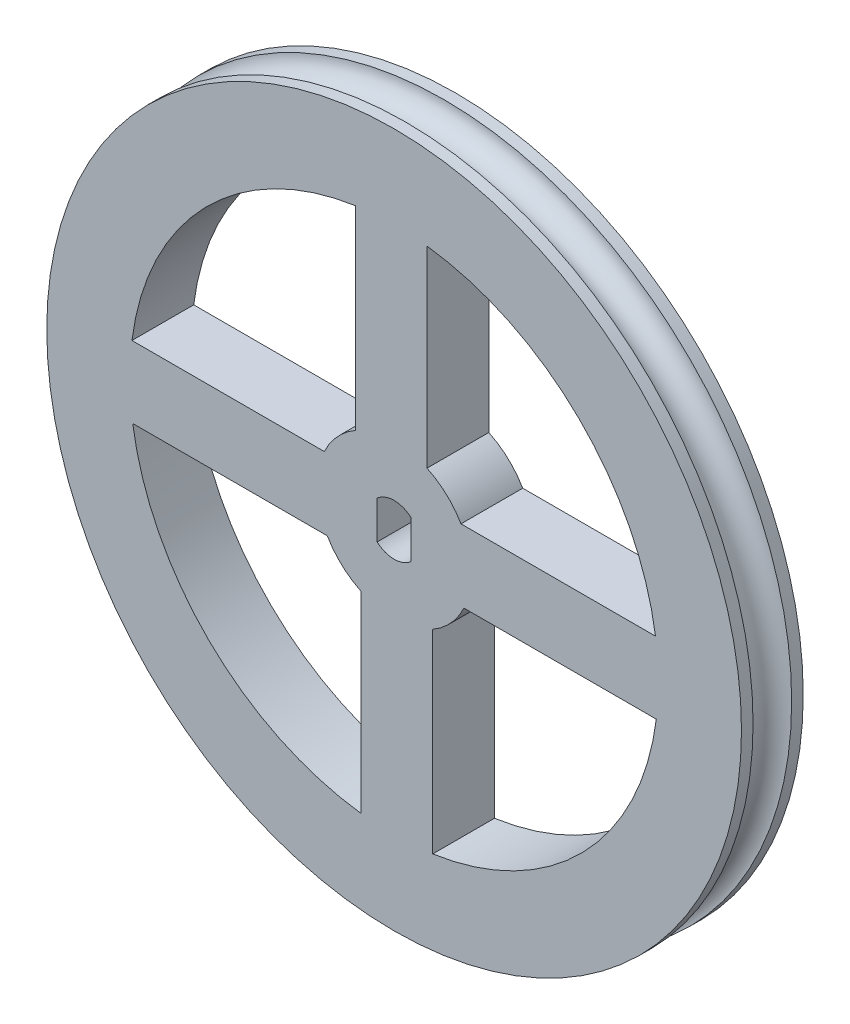
from build123d import *

# Parameters (mm, degrees)
CUT_EXTRUDE2_DEPTH = 82.458397971
CUT_EXTRUDE3_DEPTH = 82.458397971


with BuildPart() as part:
    # Sketch1 → Revolve1 (revolve)
    with BuildSketch(Plane(origin=(0, 0, 0), x_dir=(1, 0, 0), z_dir=(0, 1, 0))):
        with BuildLine():
            Line((-57.15, 0), (-57.15, -1.905))
            ThreePointArc((-57.15, -1.905), (-53.975, -5.08), (-57.15, -8.255))
            Line((-57.15, -8.255), (-57.15, -10.16))
            Line((-57.15, -10.16), (0, -10.16))
            Line((0, -10.16), (0, 0))
            Line((0, 0), (-57.15, 0))
        make_face()
    revolve(axis=Axis((0, 0, 0), (0, 0, 1)))

    # Sketch3 → Cut-Extrude2 (cut, through all)
    with BuildSketch(Plane(origin=(0, 0, 0), x_dir=(-1, 0, 0), z_dir=(0, 0, -1))):
        with BuildLine():
            Line((6.35, 43.004116755), (6.35, 10.998522628))
            ThreePointArc((6.35, 10.998522628), (9.347244518, 8.597617108), (11.489808035, 5.410574028))
            Line((11.489808035, 5.410574028), (43.132380488, 5.410574028))
            ThreePointArc((43.132380488, 5.410574028), (31.071612581, 30.401175134), (6.35, 43.004116755))
        make_face()
        with BuildLine():
            Line((5.410574028, -11.489808035), (5.410574028, -43.132380488))
            ThreePointArc((5.410574028, -43.132380488), (30.401175134, -31.071612581), (43.004116755, -6.35))
            Line((43.004116755, -6.35), (10.998522628, -6.35))
            ThreePointArc((10.998522628, -6.35), (8.597617108, -9.347244518), (5.410574028, -11.489808035))
        make_face()
        with BuildLine():
            Line((-11.489808035, -5.410574028), (-43.132380488, -5.410574028))
            ThreePointArc((-43.132380488, -5.410574028), (-31.071612581, -30.401175134), (-6.35, -43.004116755))
            Line((-6.35, -43.004116755), (-6.35, -10.998522628))
            ThreePointArc((-6.35, -10.998522628), (-9.347244518, -8.597617108), (-11.489808035, -5.410574028))
        make_face()
        with BuildLine():
            Line((-5.410574028, 11.489808035), (-5.410574028, 43.132380488))
            ThreePointArc((-5.410574028, 43.132380488), (-30.401175134, 31.071612581), (-43.004116755, 6.35))
            Line((-43.004116755, 6.35), (-10.998522628, 6.35))
            ThreePointArc((-10.998522628, 6.35), (-8.597617108, 9.347244518), (-5.410574028, 11.489808035))
        make_face()
    extrude(amount=-CUT_EXTRUDE2_DEPTH, mode=Mode.SUBTRACT)

    # Sketch6 → Cut-Extrude3 (cut, through all)
    with BuildSketch(Plane(origin=(0, 0, 0), x_dir=(-1, 0, 0), z_dir=(0, 0, -1))):
        with BuildLine():
            Line((-2.794, 3.123786965), (-2.794, -3.123786965))
            ThreePointArc((-2.794, -3.123786965), (0, -4.191), (2.794, -3.123786965))
            Line((2.794, -3.123786965), (2.794, 3.123786965))
            ThreePointArc((2.794, 3.123786965), (0, 4.191), (-2.794, 3.123786965))
        make_face()
    extrude(amount=-CUT_EXTRUDE3_DEPTH, mode=Mode.SUBTRACT)


solid = part.part
